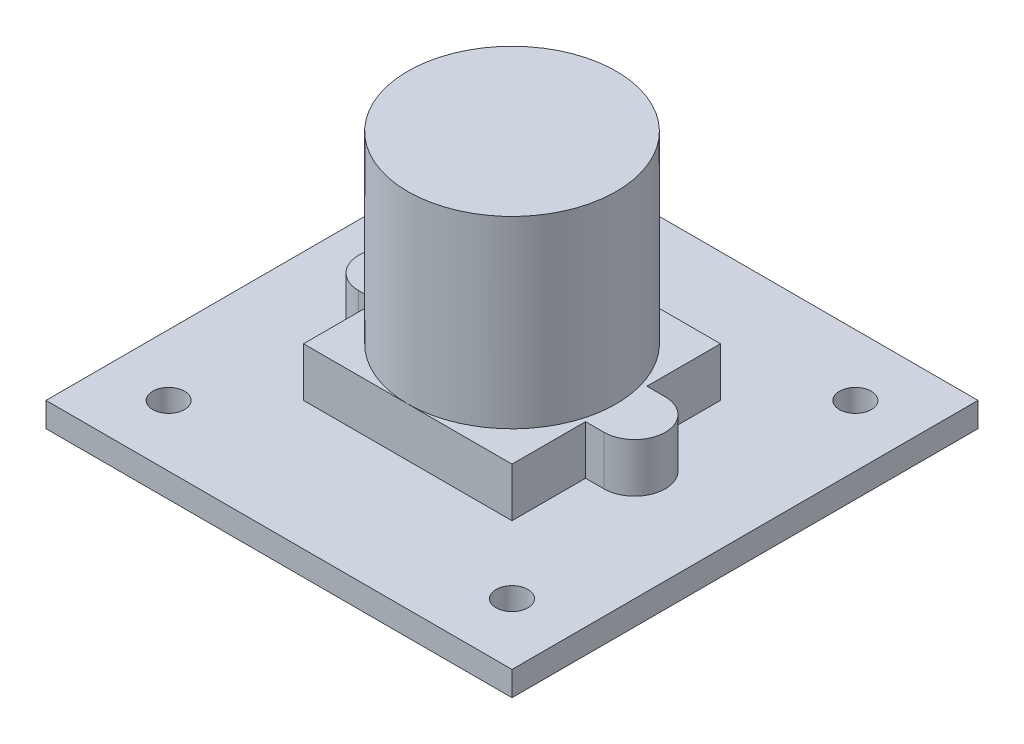
from build123d import *

# Parameters (mm, degrees)
SKETCH_1_W      = 38
SKETCH_1_H      = 38
SKETCH_1_R      = 1.3
EXTRUDE_1_DEPTH = 2
SKETCH_2_W      = 17
SKETCH_2_H      = 17
EXTRUDE_2_DEPTH = 4
SKETCH_3_R      = 8.5
EXTRUDE_3_DEPTH = 15
EXTRUDE_4_DEPTH = 4


with BuildPart() as part:
    # 草图1 → 凸台-拉伸1 (new body)
    with BuildSketch(Plane(origin=(0, 0, 0), x_dir=(1, 0, 0), z_dir=(0, 1, 0))):
        Rectangle(SKETCH_1_W, SKETCH_1_H)
        with Locations(Location((-14, -14, 0), (0, 0, 270))):
            Circle(SKETCH_1_R, mode=Mode.SUBTRACT)
        with Locations(Location((-14, 14, 0), (0, 0, 270))):
            Circle(SKETCH_1_R, mode=Mode.SUBTRACT)
        with Locations(Location((14, 14, 0), (0, 0, 270))):
            Circle(SKETCH_1_R, mode=Mode.SUBTRACT)
        with Locations(Location((14, -14, 0), (0, 0, 270))):
            Circle(SKETCH_1_R, mode=Mode.SUBTRACT)
    extrude(amount=EXTRUDE_1_DEPTH)

    # 草图2 → 凸台-拉伸2 (add)
    with BuildSketch(Plane(origin=(0, 2, 0), x_dir=(1, 0, 0), z_dir=(0, 1, 0))):
        Rectangle(SKETCH_2_W, SKETCH_2_H)
    extrude(amount=EXTRUDE_2_DEPTH)

    # 草图3 → 凸台-拉伸3 (add)
    with BuildSketch(Plane(origin=(0, 6, 0), x_dir=(1, 0, 0), z_dir=(0, 1, 0))):
        with Locations(Location((0, 0, 0), (0, 0, 270))):
            Circle(SKETCH_3_R)
    extrude(amount=EXTRUDE_3_DEPTH)

    # 草图4 → 凸台-拉伸4 (add)
    with BuildSketch(Plane(origin=(0, 2, 0), x_dir=(1, 0, 0), z_dir=(0, 1, 0))):
        with BuildLine():
            Line((-10, 2.5), (10, 2.5))
            ThreePointArc((10, 2.5), (12.5, 0), (10, -2.5))
            Line((10, -2.5), (-10, -2.5))
            ThreePointArc((-10, -2.5), (-12.5, 0), (-10, 2.5))
        make_face()
    extrude(amount=EXTRUDE_4_DEPTH)


solid = part.part
